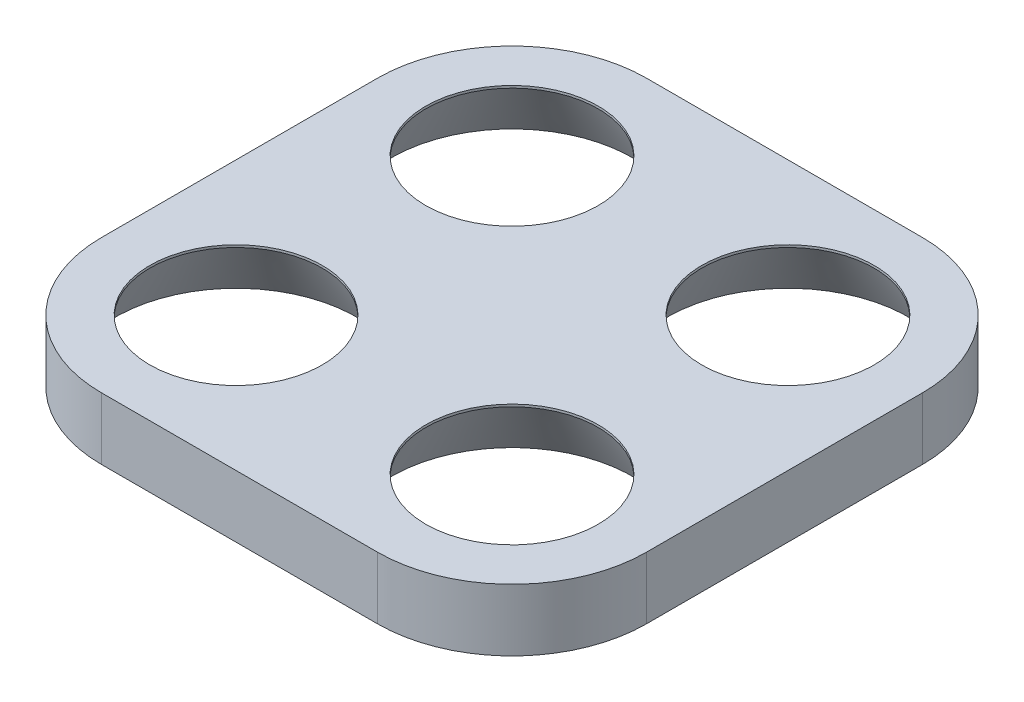
from build123d import *

# Parameters (mm, degrees)
SKETCH1_W           = 15.8
SKETCH1_H           = 15.8
BOSS_EXTRUDE1_DEPTH = 1.8
CUT_EXTRUDE1_REACH  = 13.316
SKETCH2_R           = 2.5
FILLET1_R           = 3.9
CHAMFER1_SIZE       = 1
CHAMFER1_SIZE2      = 1.732050808


with BuildPart() as part:
    # Sketch1 → Boss-Extrude1 (new body)
    with BuildSketch(Plane(origin=(0, 0, 0), x_dir=(1, 0, 0), z_dir=(0, 1, 0))):
        Rectangle(SKETCH1_W, SKETCH1_H)
    extrude(amount=BOSS_EXTRUDE1_DEPTH)

    # Sketch2 → Cut-Extrude1 (cut, up to next)
    with BuildSketch(Plane(origin=(0, 1.8, 0), x_dir=(1, 0, 0), z_dir=(0, 1, 0)), mode=Mode.PRIVATE) as cut_extrude1_sk1:
        with Locations(Location((-4, 4, 0), (0, 0, 270))):
            Circle(SKETCH2_R)
    cut_extrude1_tool1 = extrude(cut_extrude1_sk1.sketch, amount=-CUT_EXTRUDE1_REACH, mode=Mode.PRIVATE) & part.part
    # Sketch2 → Cut-Extrude1 (cut, up to next)
    with BuildSketch(Plane(origin=(0, 1.8, 0), x_dir=(1, 0, 0), z_dir=(0, 1, 0)), mode=Mode.PRIVATE) as cut_extrude1_sk2:
        with Locations(Location((4, 4, 0), (0, 0, 270))):
            Circle(SKETCH2_R)
    cut_extrude1_tool2 = extrude(cut_extrude1_sk2.sketch, amount=-CUT_EXTRUDE1_REACH, mode=Mode.PRIVATE) & part.part
    # Sketch2 → Cut-Extrude1 (cut, up to next)
    with BuildSketch(Plane(origin=(0, 1.8, 0), x_dir=(1, 0, 0), z_dir=(0, 1, 0)), mode=Mode.PRIVATE) as cut_extrude1_sk3:
        with Locations(Location((4, -4, 0), (0, 0, 270))):
            Circle(SKETCH2_R)
    cut_extrude1_tool3 = extrude(cut_extrude1_sk3.sketch, amount=-CUT_EXTRUDE1_REACH, mode=Mode.PRIVATE) & part.part
    # Sketch2 → Cut-Extrude1 (cut, up to next)
    with BuildSketch(Plane(origin=(0, 1.8, 0), x_dir=(1, 0, 0), z_dir=(0, 1, 0)), mode=Mode.PRIVATE) as cut_extrude1_sk4:
        with Locations(Location((-4, -4, 0), (0, 0, 270))):
            Circle(SKETCH2_R)
    cut_extrude1_tool4 = extrude(cut_extrude1_sk4.sketch, amount=-CUT_EXTRUDE1_REACH, mode=Mode.PRIVATE) & part.part
    add(cut_extrude1_tool1.solids().sort_by_distance((-4, 1.8, -4))[0], mode=Mode.SUBTRACT)
    add(cut_extrude1_tool2.solids().sort_by_distance((4, 1.8, -4))[0], mode=Mode.SUBTRACT)
    add(cut_extrude1_tool3.solids().sort_by_distance((4, 1.8, 4))[0], mode=Mode.SUBTRACT)
    add(cut_extrude1_tool4.solids().sort_by_distance((-4, 1.8, 4))[0], mode=Mode.SUBTRACT)

    # Fillet1
    fillet1_edges = [part.edges().sort_by_distance(p)[0] for p in [
        (-7.9, 0.9, -7.9),
        (7.9, 0.9, -7.9),
        (7.9, 0.9, 7.9),
        (-7.9, 0.9, 7.9),
    ]]
    fillet(fillet1_edges, radius=FILLET1_R)

    # Chamfer1
    chamfer1_edges = [part.edges().sort_by_distance(p)[0] for p in [
        (-4, 0, 1.5),
        (4, 0, 1.5),
        (4, 0, -6.5),
        (-4, 0, -6.5),
    ]]
    chamfer1_side = [part.faces().sort_by_distance(p)[0] for p in [
        (0, 0, 0),
    ]]
    chamfer(chamfer1_edges, length=CHAMFER1_SIZE, length2=CHAMFER1_SIZE2, reference=chamfer1_side[0])


solid = part.part
